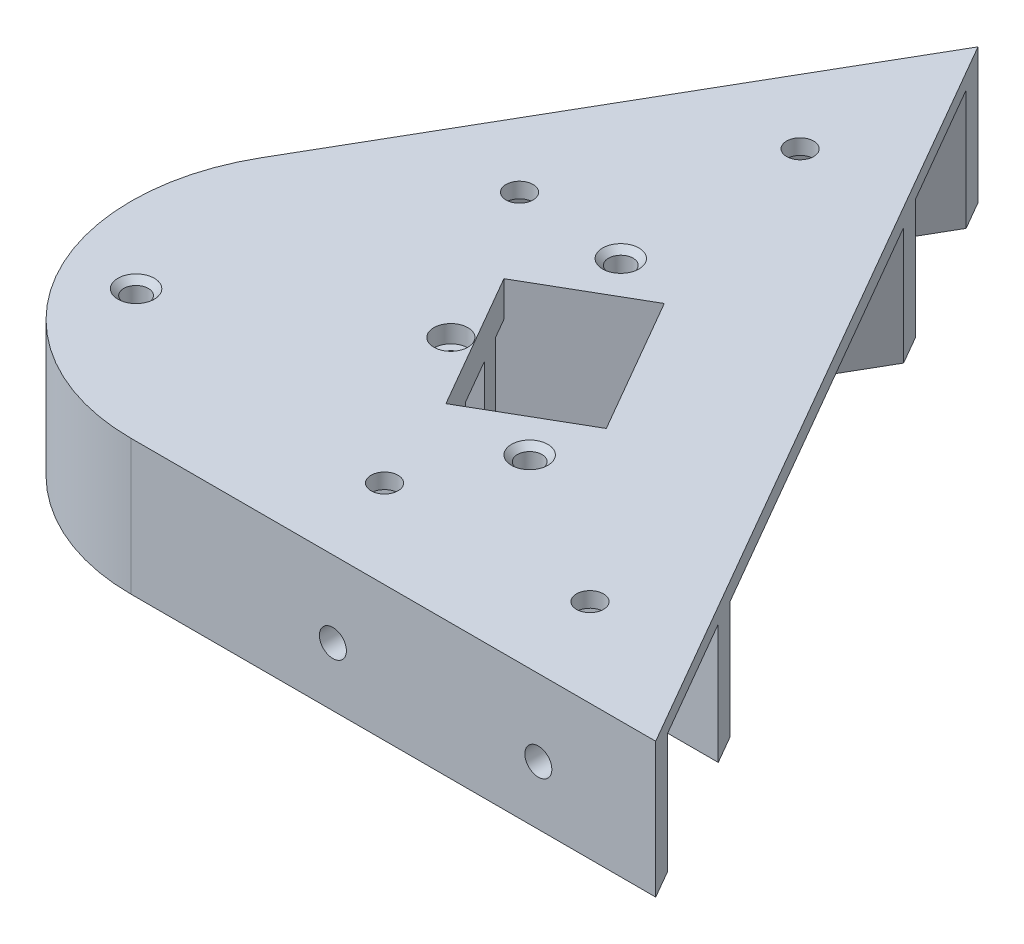
from build123d import *

# Parameters (mm, degrees)
BOSS_EXTRUDE1_DEPTH      = 23
SKETCH2_W                = 100.4
SKETCH2_H                = 20.4
CUT_EXTRUDE2_DEPTH       = 20.4
CUT_EXTRUDE3_DEPTH       = 20
SKETCH7_R                = 2.3
CUT_EXTRUDE6_DEPTH       = 10
SKETCH8_R                = 2.3
CUT_EXTRUDE7_DEPTH       = 10
FILLET3_R                = 35
CUT_EXTRUDE11_DEPTH      = 200.759855827
CUT_EXTRUDE11_DEPTH_BACK = 200.759855827
CUT_EXTRUDE10_DEPTH      = 20
BOSS_EXTRUDE3_DEPTH      = 6
BOSS_EXTRUDE4_DEPTH      = 17
CUT_EXTRUDE14_DEPTH      = 17
SKETCH30_R               = 1.5
CUT_EXTRUDE15_DEPTH      = 200.158228552
SKETCH31_R               = 2.9
CUT_EXTRUDE17_DEPTH      = 3
SKETCH32_R               = 2.3
CUT_EXTRUDE18_DEPTH      = 10
SKETCH33_R               = 2.3
CUT_EXTRUDE19_DEPTH      = 10
SKETCH34_R               = 2.3
CUT_EXTRUDE20_DEPTH      = 149.465956609
SKETCH35_R               = 4
CUT_EXTRUDE21_DEPTH      = 154.248582194
SKETCH36_R               = 2.1
CUT_EXTRUDE22_DEPTH      = 5
SKETCH37_R               = 2.1
CUT_EXTRUDE23_DEPTH      = 5
SKETCH38_R               = 2.3
CUT_EXTRUDE24_DEPTH      = 10
CHAMFER1_SIZE            = 1


with BuildPart() as part:
    # Sketch1 → Boss-Extrude1 (new body)
    with BuildSketch(Plane(origin=(0, 0, 0), x_dir=(1, 0, 0), z_dir=(0, 1, 0))):
        Polygon((0, 0), (150, 0), (75, 129.903810568), align=None)
    extrude(amount=BOSS_EXTRUDE1_DEPTH)

    # Sketch2 → Cut-Extrude2 (cut)
    with BuildSketch(Plane(origin=(0, 0, 0), x_dir=(1, 0, 0), z_dir=(0, 1, 0))):
        Polygon((108.923840175, 138.261625339), (58.723840175, 51.312674799), (41.056921938, 61.512674799), (91.256921938, 148.461625339), align=None)
        with Locations((124, 15)):
            Rectangle(SKETCH2_W, SKETCH2_H)
    extrude(amount=CUT_EXTRUDE2_DEPTH, mode=Mode.SUBTRACT)

    # Sketch4 → Cut-Extrude3 (cut)
    with BuildSketch(Plane(origin=(0, 0, 0), x_dir=(1, 0, 0), z_dir=(0, 1, 0))):
        Polygon((58.515583945, 45.561933634), (40.848665708, 35.361933634), (51.048665708, 17.695015397), (68.715583945, 27.895015397), align=None)
    extrude(amount=CUT_EXTRUDE3_DEPTH, mode=Mode.SUBTRACT)

    # Sketch7 → Cut-Extrude6 (cut)
    with BuildSketch(Plane(origin=(0, 0, 0), x_dir=(-0.4999999999999978, 0, 0.86602540378444), z_dir=(-0.86602540378444, 0, -0.4999999999999978))):
        with Locations((-130, 10)):
            Circle(SKETCH7_R)
        with Locations((-95, 10)):
            Circle(SKETCH7_R)
    extrude(amount=-CUT_EXTRUDE6_DEPTH, mode=Mode.SUBTRACT)

    # Sketch8 → Cut-Extrude7 (cut)
    with BuildSketch(Plane.XY):
        with Locations((130, 10)):
            Circle(SKETCH8_R)
        with Locations((95, 10)):
            Circle(SKETCH8_R)
    extrude(amount=-CUT_EXTRUDE7_DEPTH, mode=Mode.SUBTRACT)

    # Fillet3
    fillet3_edges = [part.edges().sort_by_distance(p)[0] for p in [
        (0, 11.5, 0),
    ]]
    fillet(fillet3_edges, radius=FILLET3_R)

    # Sketch22 → Cut-Extrude11 (cut, two sides: drawn at the far end of the back side and taken through both)
    with BuildSketch(Plane.XZ.offset(-CUT_EXTRUDE11_DEPTH_BACK)):
        Polygon((76.257198908, -28.438657049), (62.757198908, -51.821342951), (86.13988481, -65.321342951), (99.63988481, -41.938657049), align=None)
    extrude(amount=CUT_EXTRUDE11_DEPTH + CUT_EXTRUDE11_DEPTH_BACK, mode=Mode.SUBTRACT)

    # Sketch21 → Cut-Extrude10 (cut)
    with BuildSketch(Plane.XZ):
        Polygon((132.679491924, -30), (109.996773286, -30), (80.979148757, -80.26), (92.320508076, -99.903810568), align=None)
    extrude(amount=-CUT_EXTRUDE10_DEPTH, mode=Mode.SUBTRACT)

    # Sketch27 → Boss-Extrude3 (add)
    with BuildSketch(Plane(origin=(0, 23, 0), x_dir=(1, 0, 0), z_dir=(0, 1, 0))):
        Polygon((76.257198908, 28.438657049), (62.757198908, 51.821342951), (68.819376734, 55.321342951), (82.319376734, 31.938657049), align=None)
    extrude(amount=-BOSS_EXTRUDE3_DEPTH)

    # Sketch28 → Boss-Extrude4 (add)
    with BuildSketch(Plane.XZ.offset(-17)):
        Polygon((74.257198908, -31.902758664), (64.757198908, -48.357241336), (70.819376734, -51.857241336), (80.319376734, -35.402758664), align=None)
    extrude(amount=BOSS_EXTRUDE4_DEPTH)

    # Sketch29 → Cut-Extrude14 (cut)
    with BuildSketch(Plane.XZ):
        Polygon((77.819376734, -39.732885683), (71.757198908, -36.232885683), (67.257198908, -44.027114317), (73.319376734, -47.527114317), align=None)
    extrude(amount=-CUT_EXTRUDE14_DEPTH, mode=Mode.SUBTRACT)

    # Sketch30 → Cut-Extrude15 (cut, through all)
    with BuildSketch(Plane.XZ.offset(-17)):
        with Locations(Location((72.971300523, -42.13, 0), (0, 0, 270))):
            Circle(SKETCH30_R)
    extrude(amount=-CUT_EXTRUDE15_DEPTH, mode=Mode.SUBTRACT)

    # Sketch31 → Cut-Extrude17 (cut)
    with BuildSketch(Plane(origin=(0, 23, 0), x_dir=(1, 0, 0), z_dir=(0, 1, 0))):
        with Locations(Location((72.971300523, 42.13, 0), (0, 0, 270))):
            Circle(SKETCH31_R)
    extrude(amount=-CUT_EXTRUDE17_DEPTH, mode=Mode.SUBTRACT)

    # Sketch32 → Cut-Extrude18 (cut)
    with BuildSketch(Plane(origin=(0, 0, -30), x_dir=(-1, 0, 0), z_dir=(0, 0, -1))):
        with Locations((-121.338132605, 10)):
            Circle(SKETCH32_R)
    extrude(amount=-CUT_EXTRUDE18_DEPTH, mode=Mode.SUBTRACT)

    # Sketch33 → Cut-Extrude19 (cut)
    with BuildSketch(Plane(origin=(25.980762114, 0, 15), x_dir=(0.4999999999999997, 0, -0.8660254037844388), z_dir=(0.8660254037844389, 0, 0.49999999999999983))):
        with Locations((121.338132605, 10)):
            Circle(SKETCH33_R)
    extrude(amount=-CUT_EXTRUDE19_DEPTH, mode=Mode.SUBTRACT)

    # Sketch34 → Cut-Extrude20 (cut, through all)
    with BuildSketch(Plane(origin=(45.948665708, 0, -26.528474516), x_dir=(-0.5000000000000001, 0, -0.8660254037844386), z_dir=(0.8660254037844386, 0, -0.5000000000000001))):
        with Locations((0, 10)):
            Circle(SKETCH34_R)
    extrude(amount=-CUT_EXTRUDE20_DEPTH, mode=Mode.SUBTRACT)

    # Sketch35 → Cut-Extrude21 (cut, through all)
    with BuildSketch(Plane(origin=(41.618538689, 0, -24.028474516), x_dir=(-0.5000000000000001, 0, -0.8660254037844386), z_dir=(0.8660254037844386, 0, -0.5000000000000001))):
        with Locations((0, 10)):
            Circle(SKETCH35_R)
    extrude(amount=-CUT_EXTRUDE21_DEPTH, mode=Mode.SUBTRACT)

    # Sketch36 → Cut-Extrude22 (cut)
    with BuildSketch(Plane(origin=(0, 23, 0), x_dir=(1, 0, 0), z_dir=(0, 1, 0))):
        with Locations(Location((38.97114317, 22.5, 0), (0, 0, 270))):
            Circle(SKETCH36_R)
    extrude(amount=-CUT_EXTRUDE22_DEPTH, mode=Mode.SUBTRACT)

    # Sketch37 → Cut-Extrude23 (cut)
    with BuildSketch(Plane(origin=(0, 23, 0), x_dir=(1, 0, 0), z_dir=(0, 1, 0))):
        with Locations(Location((97.007764662, 31.519733426, 0), (0, 0, 270))):
            Circle(SKETCH37_R)
        with Locations(Location((75.800772199, 68.251321849, 0), (0, 0, 270))):
            Circle(SKETCH37_R)
    extrude(amount=-CUT_EXTRUDE23_DEPTH, mode=Mode.SUBTRACT)

    # Sketch38 → Cut-Extrude24 (cut)
    with BuildSketch(Plane.XZ.offset(-20.4)):
        with Locations(Location((88.8, -15, 0), (0, 0, 270))):
            Circle(SKETCH38_R)
        with Locations(Location((123.8, -15, 0), (0, 0, 270))):
            Circle(SKETCH38_R)
        with Locations(Location((57.390381057, -69.403055856, 0), (0, 0, 270))):
            Circle(SKETCH38_R)
        with Locations(Location((74.890381057, -99.713944989, 0), (0, 0, 270))):
            Circle(SKETCH38_R)
    extrude(amount=-CUT_EXTRUDE24_DEPTH, mode=Mode.SUBTRACT)

    # Chamfer1
    chamfer1_edges = [part.edges().sort_by_distance(p)[0] for p in [
        (38.97114317, 23, -24.6),
        (97.007764662, 23, -33.619733426),
        (75.800772199, 23, -70.351321849),
    ]]
    chamfer(chamfer1_edges, length=CHAMFER1_SIZE)


solid = part.part
